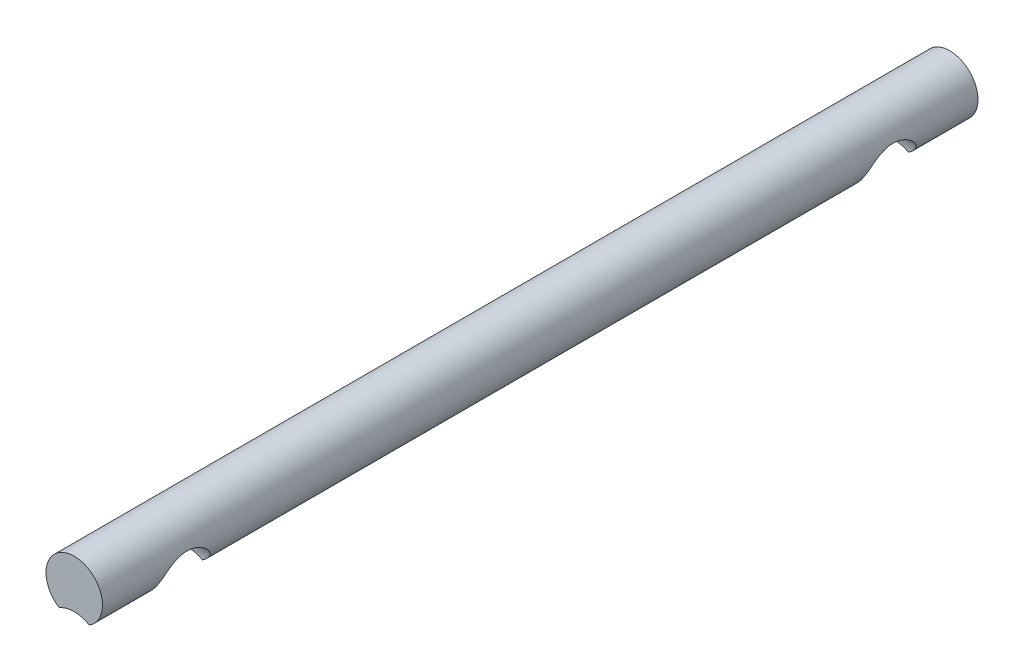
from build123d import *

# Parameters (mm, degrees)
EXTRUDE_1_DEPTH     = 1550
SKETCH_2_R          = 100
CUT_EXTRUDE_1_DEPTH = 3000


with BuildPart() as part:
    # Эскиз1 → Бобышка-Вытянуть1 (new, symmetric)
    with BuildSketch(Plane.XY):
        with BuildLine():
            ThreePointArc((100, 0), (70.710678119, 70.710678119), (0, 100))
            Line((0, 100), (0, -70))
            ThreePointArc((0, -70), (27.658633372, -73.708341903), (53.363596856, -84.571428571))
            ThreePointArc((53.363596856, -84.571428571), (87.568143995, -48.288923753), (100, 0))
        make_face()
        with BuildLine():
            Line((0, -70), (0, 100))
            ThreePointArc((0, 100), (-96.065453877, 27.774602993), (-53.363596856, -84.571428571))
            ThreePointArc((-53.363596856, -84.571428571), (-27.658633372, -73.708341903), (0, -70))
        make_face()
        with BuildLine():
            ThreePointArc((100, 0), (70.710678119, 70.710678119), (0, 100))
            Line((0, 100), (0, -70))
            ThreePointArc((0, -70), (27.658633372, -73.708341903), (53.363596856, -84.571428571))
            ThreePointArc((53.363596856, -84.571428571), (87.568143995, -48.288923753), (100, 0))
        make_face()
        with BuildLine():
            Line((0, -70), (0, 100))
            ThreePointArc((0, 100), (-96.065453877, 27.774602993), (-53.363596856, -84.571428571))
            ThreePointArc((-53.363596856, -84.571428571), (-27.658633372, -73.708341903), (0, -70))
        make_face()
    extrude(amount=EXTRUDE_1_DEPTH, both=True)

    # Эскиз2 → Вырез-Вытянуть1 (cut, symmetric)
    with BuildSketch(Plane(origin=(0, 0, 0), x_dir=(0, 0, -1), z_dir=(1, 0, 0))):
        with Locations((-1250, -84.571428571)):
            Circle(SKETCH_2_R)
        with Locations((1250, -84.571428571)):
            Circle(SKETCH_2_R)
    extrude(amount=CUT_EXTRUDE_1_DEPTH, both=True, mode=Mode.SUBTRACT)


solid = part.part
